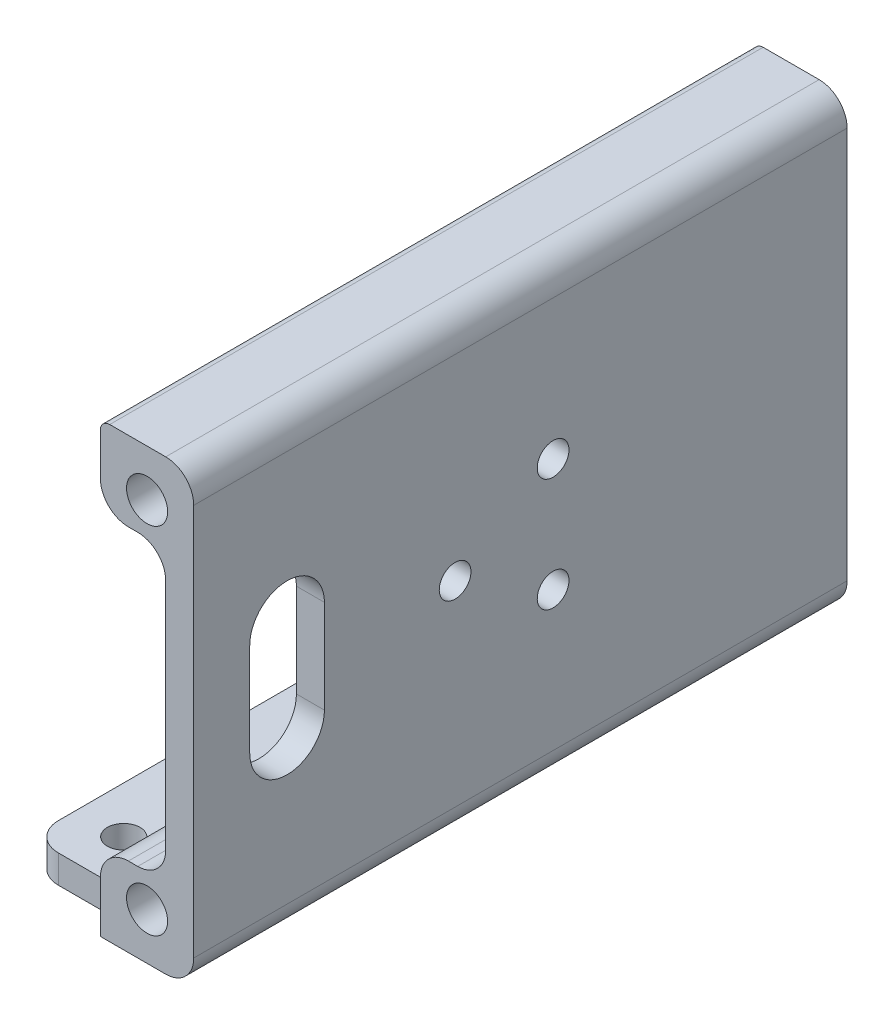
from build123d import *

# Parameters (mm, degrees)
BOSS_EXTRUDE1_DEPTH = 70
SKETCH2_R           = 2.2
CUT_EXTRUDE1_DEPTH  = 5.3
FILLET1_R           = 1
SKETCH4_R           = 1.7
CUT_EXTRUDE3_DEPTH  = 10
SKETCH5_R           = 1.75
BOSS_EXTRUDE2_DEPTH = 3
CHAMFER1_SIZE       = 1


with BuildPart() as part:
    # Sketch1 → Boss-Extrude1 (new body)
    with BuildSketch(Plane.XY):
        with BuildLine():
            Line((49, 24), (49, 18.5))
            ThreePointArc((49, 18.5), (49.878679656, 16.378679656), (52, 15.5))
            Line((52, 15.5), (53, 15.5))
            ThreePointArc((53, 15.5), (55.121320344, 14.621320344), (56, 12.5))
            Line((56, 12.5), (56, -12.5))
            ThreePointArc((56, -12.5), (55.121320344, -14.621320344), (53, -15.5))
            Line((53, -15.5), (52, -15.5))
            ThreePointArc((52, -15.5), (49.878679656, -16.378679656), (49, -18.5))
            Line((49, -18.5), (49, -24))
            Line((49, -24), (56, -24))
            ThreePointArc((56, -24), (58.121320344, -23.121320344), (59, -21))
            Line((59, -21), (59, 21))
            ThreePointArc((59, 21), (58.121320344, 23.121320344), (56, 24))
            Line((56, 24), (49, 24))
        make_face()
    extrude(amount=BOSS_EXTRUDE1_DEPTH)

    # Sketch2 → Cut-Extrude1 (cut)
    with BuildSketch(Plane(origin=(0, 0, 0), x_dir=(-1, 0, 0), z_dir=(0, 0, -1))):
        with Locations((-54, -19)):
            Circle(SKETCH2_R)
        with Locations((-54, 19)):
            Circle(SKETCH2_R)
    cut_extrude1 = extrude(amount=-CUT_EXTRUDE1_DEPTH, mode=Mode.SUBTRACT)

    # Mirror1: Cut-Extrude1 across plane
    add(cut_extrude1.mirror(Plane(origin=(0, 0, 35), x_dir=(1, 0, 0), z_dir=(0, 0, -1))), mode=Mode.SUBTRACT)

    # Fillet1
    fillet1_edges = [part.edges().sort_by_distance(p)[0] for p in [
        (49, 24, 35),
    ]]
    fillet(fillet1_edges, radius=FILLET1_R)

    # Sketch4 → Cut-Extrude3 (cut)
    with BuildSketch(Plane(origin=(59, 0, 0), x_dir=(0, 0, -1), z_dir=(1, 0, 0))):
        with Locations(Location((-42, 0, 0), (0, 0, 90))):
            Circle(SKETCH4_R)
        with Locations(Location((-31.5, 6.062177826, 0), (0, 0, 90))):
            Circle(SKETCH4_R)
        with Locations(Location((-31.5, -6.062177826, 0), (0, 0, 90))):
            Circle(SKETCH4_R)
        with BuildLine():
            Line((-64, -5), (-64, 5))
            ThreePointArc((-64, 5), (-60, 9), (-56, 5))
            Line((-56, 5), (-56, -5))
            ThreePointArc((-56, -5), (-60, -9), (-64, -5))
        make_face()
    extrude(amount=-CUT_EXTRUDE3_DEPTH, mode=Mode.SUBTRACT)

    # Sketch5 → Boss-Extrude2 (add)
    with BuildSketch(Plane.XZ.offset(24)):
        with BuildLine():
            Line((49, 2.5), (42, 2.5))
            ThreePointArc((42, 2.5), (39.878679656, 3.378679656), (39, 5.5))
            Line((39, 5.5), (39, 64.5))
            ThreePointArc((39, 64.5), (39.878679656, 66.621320344), (42, 67.5))
            Line((42, 67.5), (49, 67.5))
            Line((49, 67.5), (49, 2.5))
        make_face()
        with Locations((44, 62.5)):
            Circle(SKETCH5_R, mode=Mode.SUBTRACT)
        with Locations(Location((44, 7.5, 0), (0, 0, 180))):
            Circle(SKETCH5_R, mode=Mode.SUBTRACT)
    extrude(amount=-BOSS_EXTRUDE2_DEPTH)

    # Chamfer1
    chamfer1_edges = [part.edges().sort_by_distance(p)[0] for p in [
        (49, -21, 35),
        (49, -22.5, 67.5),
        (49, -22.5, 2.5),
    ]]
    chamfer(chamfer1_edges, length=CHAMFER1_SIZE)


solid = part.part
